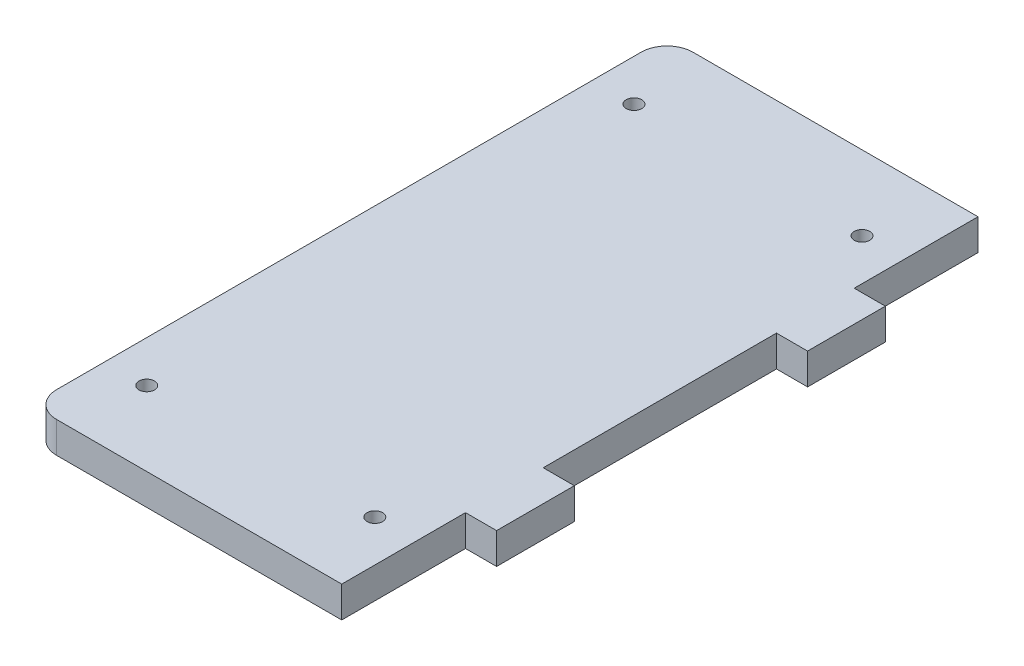
from build123d import *

# Parameters (mm, degrees)
BOSS_EXTRU_1_DEPTH      = 6
ESQUISSE3_R             = 1.5
ENL_V_MAT_EXTRU_1_DEPTH = 6
CONG_1_R                = 5
ESQUISSE6_R             = 3
ENL_V_MAT_EXTRU_2_DEPTH = 3
ENL_V_MAT_EXTRU_3_DEPTH = 2
ESQUISSE8_W             = 11
ESQUISSE8_H             = 5
ENL_V_MAT_EXTRU_4_DEPTH = 2


with BuildPart() as part:
    # Esquisse1 → Boss.-Extru.1 (new body)
    with BuildSketch(Plane(origin=(0, 0, 0), x_dir=(1, 0, 0), z_dir=(0, 1, 0))):
        Polygon((-30, 61.38), (30, 61.38), (30, 37.5), (36, 37.5), (36, 22.5), (30, 22.5), (30, -22.5), (36, -22.5), (36, -37.5), (30, -37.5), (30, -61.38), (-30, -61.38), align=None)
    extrude(amount=BOSS_EXTRU_1_DEPTH)

    # Esquisse3 → Enlèv. mat.-Extru.1 (cut)
    with BuildSketch(Plane(origin=(0, 6, 0), x_dir=(1, 0, 0), z_dir=(0, 1, 0))):
        with Locations(Location((22, 47, 0), (0, 0, 270))):
            Circle(ESQUISSE3_R)
        with Locations(Location((-22, 47, 0), (0, 0, 270))):
            Circle(ESQUISSE3_R)
        with Locations(Location((-22, -47, 0), (0, 0, 90))):
            Circle(ESQUISSE3_R)
        with Locations(Location((22, -47, 0), (0, 0, 90))):
            Circle(ESQUISSE3_R)
    extrude(amount=-ENL_V_MAT_EXTRU_1_DEPTH, mode=Mode.SUBTRACT)

    # Congé1
    cong_1_edges = [part.edges().sort_by_distance(p)[0] for p in [
        (-30, 3, -61.38),
        (-30, 3, 61.38),
    ]]
    fillet(cong_1_edges, radius=CONG_1_R)

    # Esquisse6 → Enlèv. mat.-Extru.2 (cut)
    with BuildSketch(Plane.XZ):
        with Locations(Location((22, 47, 0), (0, 0, 270))):
            Circle(ESQUISSE6_R)
        with Locations(Location((-22, 47, 0), (0, 0, 270))):
            Circle(ESQUISSE6_R)
        with Locations(Location((22, -47, 0), (0, 0, 270))):
            Circle(ESQUISSE6_R)
        with Locations(Location((-22, -47, 0), (0, 0, 270))):
            Circle(ESQUISSE6_R)
    extrude(amount=-ENL_V_MAT_EXTRU_2_DEPTH, mode=Mode.SUBTRACT)

    # Esquisse7 → Enlèv. mat.-Extru.3 (cut)
    with BuildSketch(Plane(origin=(0, 0, 0), x_dir=(-1, 0, 0), z_dir=(0, -1, 0))):
        Polygon((10.5, -36.5), (10.5, 36.5), (4.5, 36.5), (4.5, 26.5), (-4.5, 26.5), (-4.5, 36.5), (-10.5, 36.5), (-10.5, -36.5), (-4.5, -36.5), (-4.5, -26.5), (4.5, -26.5), (4.5, -36.5), align=None)
    extrude(amount=-ENL_V_MAT_EXTRU_3_DEPTH, mode=Mode.SUBTRACT)

    # Esquisse8 → Enlèv. mat.-Extru.4 (cut)
    with BuildSketch(Plane(origin=(0, 2, 0), x_dir=(-1, 0, 0), z_dir=(0, -1, 0))):
        with Locations((0, -16)):
            Rectangle(ESQUISSE8_W, ESQUISSE8_H)
        with Locations((0, 16)):
            Rectangle(ESQUISSE8_W, ESQUISSE8_H)
    extrude(amount=-ENL_V_MAT_EXTRU_4_DEPTH, mode=Mode.SUBTRACT)


solid = part.part
